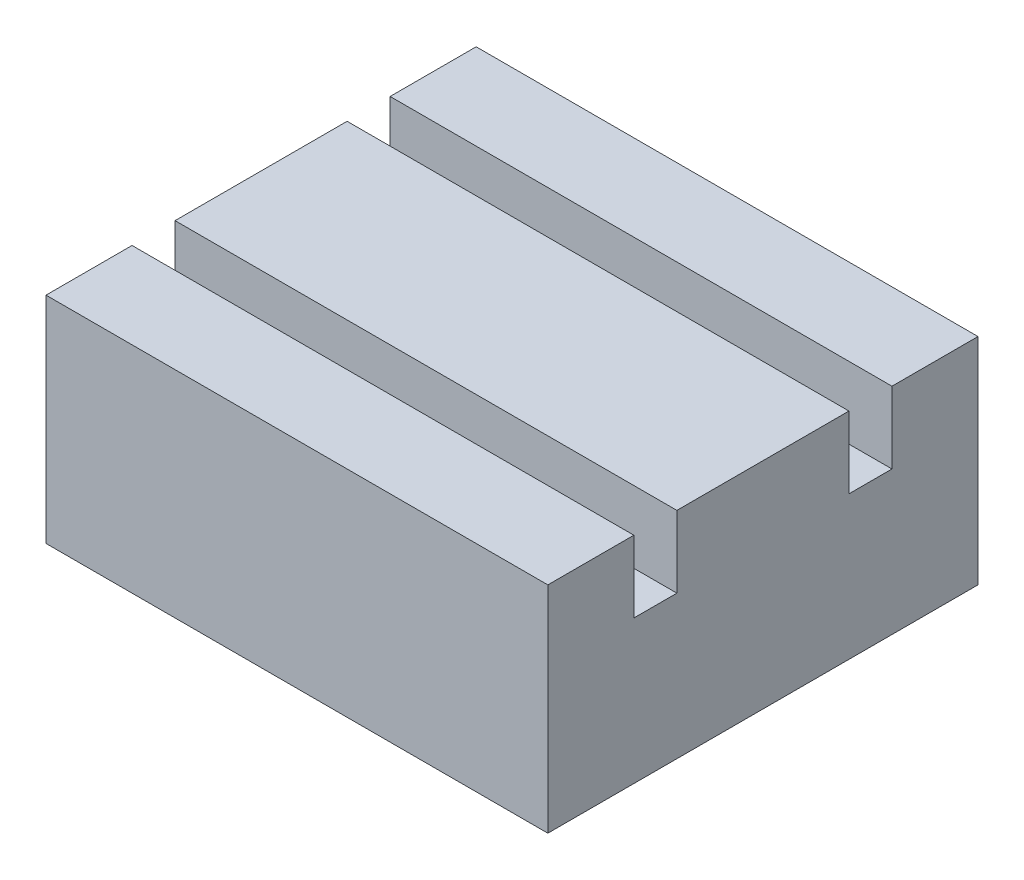
from build123d import *

# Parameters (mm, degrees)
SKETCH3_W           = 70
SKETCH3_H           = 60
BOSS_EXTRUDE1_DEPTH = 30
SKETCH4_W           = 6
SKETCH4_H           = 20
CUT_EXTRUDE1_DEPTH  = 82.853527719


with BuildPart() as part:
    # Sketch3 → Boss-Extrude1 (new body)
    with BuildSketch(Plane(origin=(0, 0, 0), x_dir=(1, 0, 0), z_dir=(0, 1, 0))):
        Rectangle(SKETCH3_W, SKETCH3_H)
    extrude(amount=-BOSS_EXTRUDE1_DEPTH)

    # Sketch4 → Cut-Extrude1 (cut, through all)
    with BuildSketch(Plane(origin=(35, 0, 0), x_dir=(0, 0, -1), z_dir=(1, 0, 0))):
        with Locations((-15, 0)):
            Rectangle(SKETCH4_W, SKETCH4_H)
    cut_extrude1 = extrude(amount=-CUT_EXTRUDE1_DEPTH, mode=Mode.SUBTRACT)

    # Mirror1: Cut-Extrude1 across plane
    add(cut_extrude1.mirror(Plane.XY), mode=Mode.SUBTRACT)


solid = part.part
